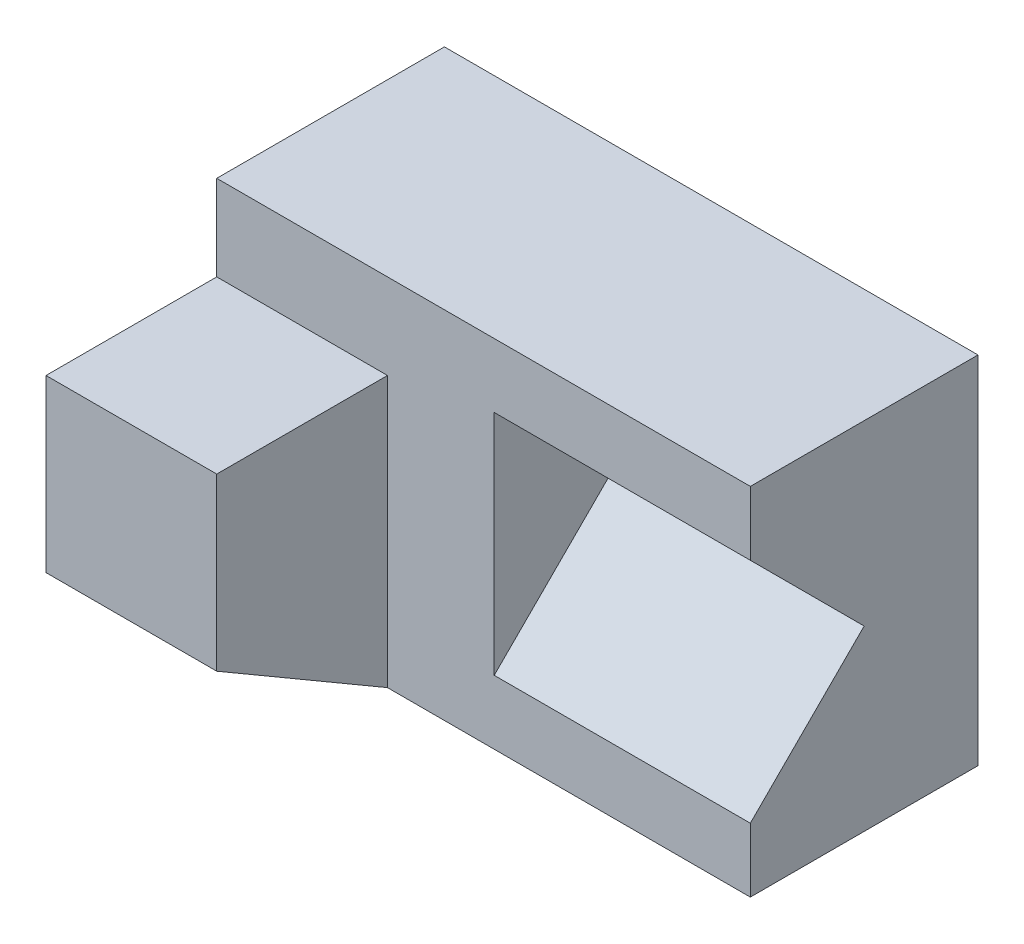
from build123d import *

# Parameters (mm, degrees)
SKETCH1_W           = 75
SKETCH1_H           = 50
BOSS_EXTRUDE1_DEPTH = 32
CUT_EXTRUDE4_DEPTH  = 36
BOSS_EXTRUDE3_DEPTH = 24


with BuildPart() as part:
    # Sketch1 → Boss-Extrude1 (new body)
    with BuildSketch(Plane.XY):
        with Locations((37.5, 25)):
            Rectangle(SKETCH1_W, SKETCH1_H)
    extrude(amount=BOSS_EXTRUDE1_DEPTH)

    # Sketch2 → Cut-Extrude4 (cut)
    with BuildSketch(Plane(origin=(75, 0, 0), x_dir=(0, 0, -1), z_dir=(1, 0, 0))):
        Polygon((-32, 41), (-16, 25), (-32, 9), align=None)
    extrude(amount=-CUT_EXTRUDE4_DEPTH, mode=Mode.SUBTRACT)

    # Sketch7 → Boss-Extrude3 (add)
    with BuildSketch(Plane.ZY):
        Polygon((32, 0), (56, 14), (56, 38), (32, 38), align=None)
    extrude(amount=-BOSS_EXTRUDE3_DEPTH)


solid = part.part
